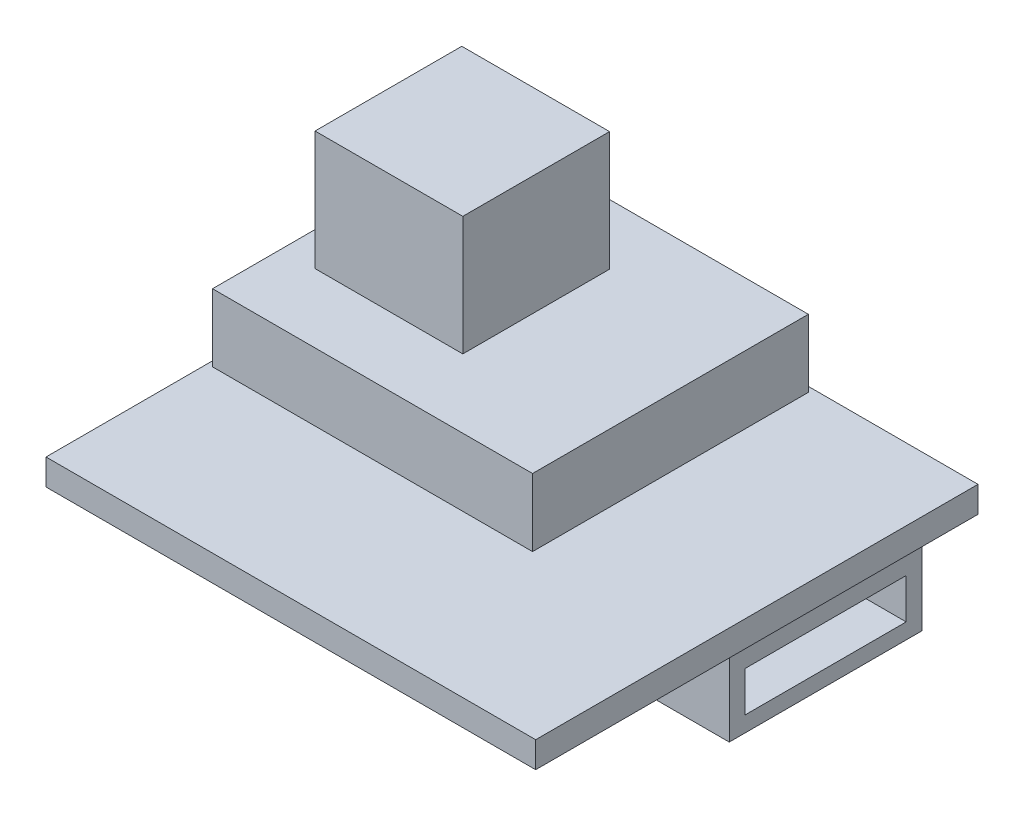
from build123d import *

# Parameters (mm, degrees)
SKETCH1_W           = 23.9014
SKETCH1_H           = 21.59
BOSS_EXTRUDE1_DEPTH = 1.27
SKETCH2_W           = 15.621
SKETCH2_H           = 13.462
BOSS_EXTRUDE2_DEPTH = 3.302
SKETCH3_W           = 7.2136
SKETCH3_H           = 7.1628
BOSS_EXTRUDE3_DEPTH = 5.8166
SKETCH4_W           = 4.191
SKETCH4_H           = 7.0358
BOSS_EXTRUDE4_DEPTH = 4.5212
SKETCH5_W           = 4.572
SKETCH5_H           = 9.398
BOSS_EXTRUDE5_DEPTH = 3.81
SKETCH6_W           = 7.874
SKETCH6_H           = 1.961854403
CUT_EXTRUDE1_DEPTH  = 3.81


with BuildPart() as part:
    # Sketch1 → Boss-Extrude1 (new body)
    with BuildSketch(Plane(origin=(0, 0, 0), x_dir=(1, 0, 0), z_dir=(0, 1, 0))):
        with Locations((11.9507, 10.795)):
            Rectangle(SKETCH1_W, SKETCH1_H)
    extrude(amount=BOSS_EXTRUDE1_DEPTH)

    # Sketch2 → Boss-Extrude2 (add)
    with BuildSketch(Plane(origin=(0, 1.27, 0), x_dir=(1, 0, 0), z_dir=(0, 1, 0))):
        with Locations((8.0645, 14.605)):
            Rectangle(SKETCH2_W, SKETCH2_H)
    extrude(amount=BOSS_EXTRUDE2_DEPTH)

    # Sketch3 → Boss-Extrude3 (add)
    with BuildSketch(Plane(origin=(0, 4.572, 0), x_dir=(1, 0, 0), z_dir=(0, 1, 0))):
        with Locations((5.5118, 14.8082)):
            Rectangle(SKETCH3_W, SKETCH3_H)
    extrude(amount=BOSS_EXTRUDE3_DEPTH)

    # Sketch4 → Boss-Extrude4 (add)
    with BuildSketch(Plane(origin=(0, 0, 0), x_dir=(-1, 0, 0), z_dir=(0, -1, 0))):
        with Locations((-10.7569, 13.3477)):
            Rectangle(SKETCH4_W, SKETCH4_H)
    extrude(amount=BOSS_EXTRUDE4_DEPTH)

    # Sketch5 → Boss-Extrude5 (add)
    with BuildSketch(Plane(origin=(0, 0, 0), x_dir=(-1, 0, 0), z_dir=(0, -1, 0))):
        with Locations((-21.3614, 14.4018)):
            Rectangle(SKETCH5_W, SKETCH5_H)
    extrude(amount=BOSS_EXTRUDE5_DEPTH)

    # Sketch6 → Cut-Extrude1 (cut)
    with BuildSketch(Plane(origin=(23.6474, 0, 0), x_dir=(0, 0, -1), z_dir=(1, 0, 0))):
        with Locations((14.4018, -2.067072798)):
            Rectangle(SKETCH6_W, SKETCH6_H)
    extrude(amount=-CUT_EXTRUDE1_DEPTH, mode=Mode.SUBTRACT)


solid = part.part
